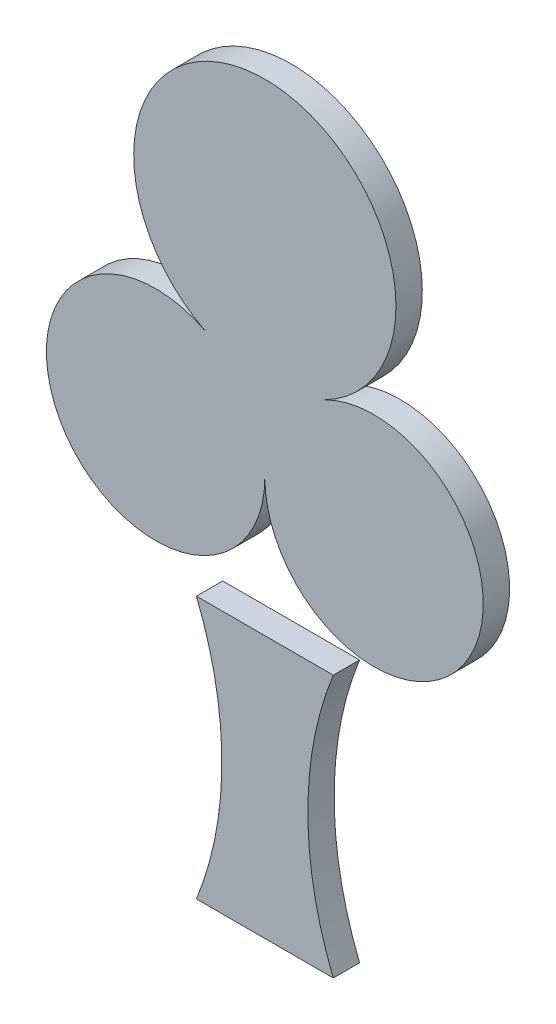
from build123d import *

# Parameters (mm, degrees)
BOSS_EXTRUDE2_DEPTH   = 3
BOSS_EXTRUDE2_2_DEPTH = 3


with BuildPart() as part:
    # Sketch1 → Boss-Extrude2 (new body)
    with BuildSketch(Plane.XY):
        with BuildLine():
            Line((7.8, 14.95), (-7.8, 14.95))
            ThreePointArc((-7.8, 14.95), (-4.9, 0), (-7.8, -14.95))
            Line((-7.8, -14.95), (7.8, -14.95))
            ThreePointArc((7.8, -14.95), (4.9, 0), (7.8, 14.95))
        make_face()
    extrude(amount=BOSS_EXTRUDE2_DEPTH)


with BuildPart() as body_2:
    # Sketch1 → Boss-Extrude2 2 (new body)
    with BuildSketch(Plane.XY):
        with BuildLine():
            ThreePointArc((6.792974735, 41.632417853), (0, 69.9), (-6.792974735, 41.632417853))
            ThreePointArc((-6.792974735, 41.632417853), (-23.066790112, 24.039066641), (0, 30.541855867))
            ThreePointArc((0, 30.541855867), (23.066790112, 24.039066641), (6.792974735, 41.632417853))
        make_face()
    extrude(amount=BOSS_EXTRUDE2_2_DEPTH)


solid = Compound([part.part, body_2.part])
